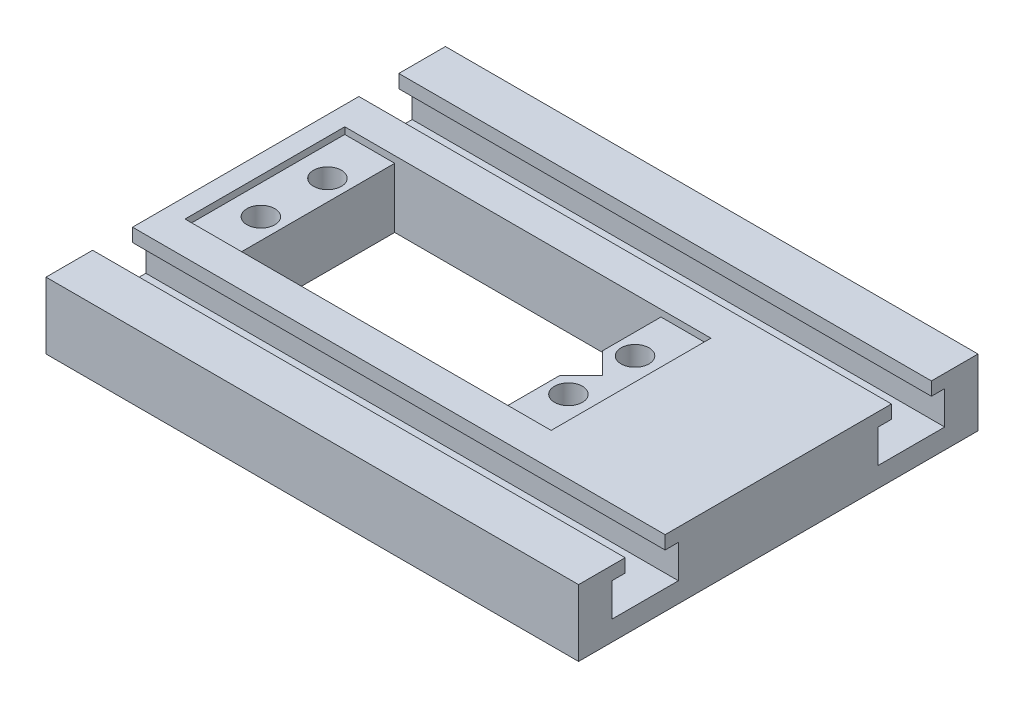
from build123d import *

# Parameters (mm, degrees)
SKETCH_1_W          = 80
SKETCH_1_H          = 60
SKETCH_1_R          = 2.1
SKETCH_1_W_2        = 40
SKETCH_1_H_2        = 24
EXTRUDE_1_DEPTH     = 10
CUT_EXTRUDE_1_DEPTH = 80
CUT_EXTRUDE_2_DEPTH = 80
SKETCH_7_W          = 55
SKETCH_7_H          = 24
CUT_EXTRUDE_3_DEPTH = 1


with BuildPart() as part:
    # 草圖1 → 填料-伸長1 (new body)
    with BuildSketch(Plane(origin=(0, 0, 0), x_dir=(1, 0, 0), z_dir=(0, 1, 0))):
        Rectangle(SKETCH_1_W, SKETCH_1_H)
        with Locations(Location((-32.72, -5, 0), (0, 0, 270))):
            Circle(SKETCH_1_R, mode=Mode.SUBTRACT)
        with Locations(Location((-32.72, 5, 0), (0, 0, 270))):
            Circle(SKETCH_1_R, mode=Mode.SUBTRACT)
        with Locations(Location((13.48, -5, 0), (0, 0, 270))):
            Circle(SKETCH_1_R, mode=Mode.SUBTRACT)
        with Locations(Location((13.48, 5, 0), (0, 0, 270))):
            Circle(SKETCH_1_R, mode=Mode.SUBTRACT)
        with Locations((-9.62, 0)):
            Rectangle(SKETCH_1_W_2, SKETCH_1_H_2, mode=Mode.SUBTRACT)
    extrude(amount=EXTRUDE_1_DEPTH)

    # 草圖4 → 除料-伸長1 (cut)
    with BuildSketch(Plane(origin=(40, 0, 0), x_dir=(0, 0, -1), z_dir=(1, 0, 0))):
        Polygon((-23, 10), (-23, 8), (-25, 8), (-25, 3), (-15, 3), (-15, 8), (-17, 8), (-17, 10), align=None)
        Polygon((17, 10), (17, 8), (15, 8), (15, 3), (25, 3), (25, 8), (23, 8), (23, 10), align=None)
    extrude(amount=-CUT_EXTRUDE_1_DEPTH, mode=Mode.SUBTRACT)

    # 草圖5 → 除料-伸長2 (cut)
    with BuildSketch(Plane(origin=(0, 10, 0), x_dir=(1, 0, 0), z_dir=(0, 1, 0))):
        Polygon((10.38, 3.25), (13.63, 0), (10.38, -3.25), align=None)
    extrude(amount=-CUT_EXTRUDE_2_DEPTH, mode=Mode.SUBTRACT)

    # 草圖7 → 除料-伸長3 (cut)
    with BuildSketch(Plane(origin=(0, 10, 0), x_dir=(1, 0, 0), z_dir=(0, 1, 0))):
        with Locations((-9.62, 0)):
            Rectangle(SKETCH_7_W, SKETCH_7_H)
    extrude(amount=-CUT_EXTRUDE_3_DEPTH, mode=Mode.SUBTRACT)


solid = part.part
